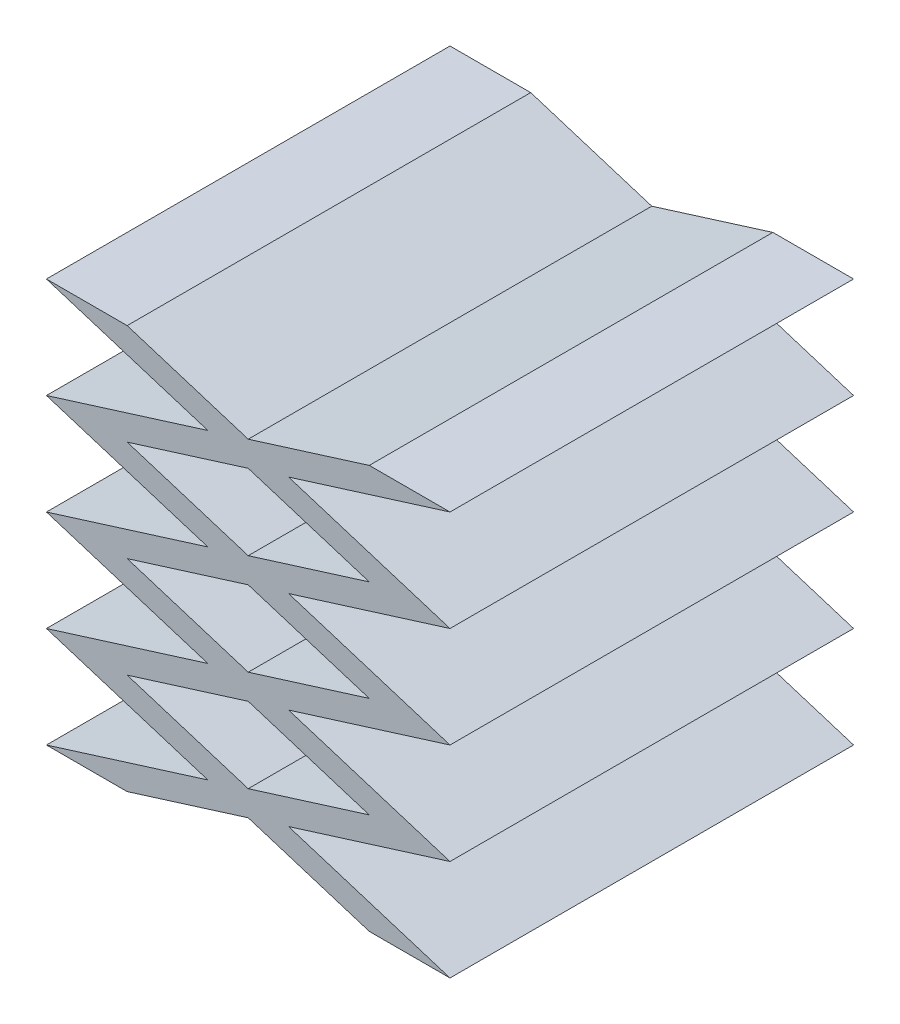
from build123d import *

# Parameters (mm, degrees)
BOSS_EXTRUDE2_DEPTH = 5


with BuildPart() as part:
    # Sketch1 → Boss-Extrude2 (new body)
    with BuildSketch(Plane.XY):
        Polygon((2, 0.625), (0, 0), (1, 0), (2.5, 0.46875), (4, 0), (5, 0), (3, 0.625), (5, 1.25), (3, 1.875), (5, 2.5), (3, 3.125), (5, 3.75), (3, 4.375), (5, 5), (4, 5), (2.5, 4.53125), (1, 5), (0, 5), (2, 4.375), (0, 3.75), (2, 3.125), (0, 2.5), (2, 1.875), (0, 1.25), align=None)
        Polygon((1, 1.25), (2.5, 1.71875), (4, 1.25), (2.5, 0.78125), align=None, mode=Mode.SUBTRACT)
        Polygon((2.5, 2.03125), (1, 2.5), (2.5, 2.96875), (4, 2.5), align=None, mode=Mode.SUBTRACT)
        Polygon((1, 3.75), (2.5, 4.21875), (4, 3.75), (2.5, 3.28125), align=None, mode=Mode.SUBTRACT)
    extrude(amount=BOSS_EXTRUDE2_DEPTH)


solid = part.part
